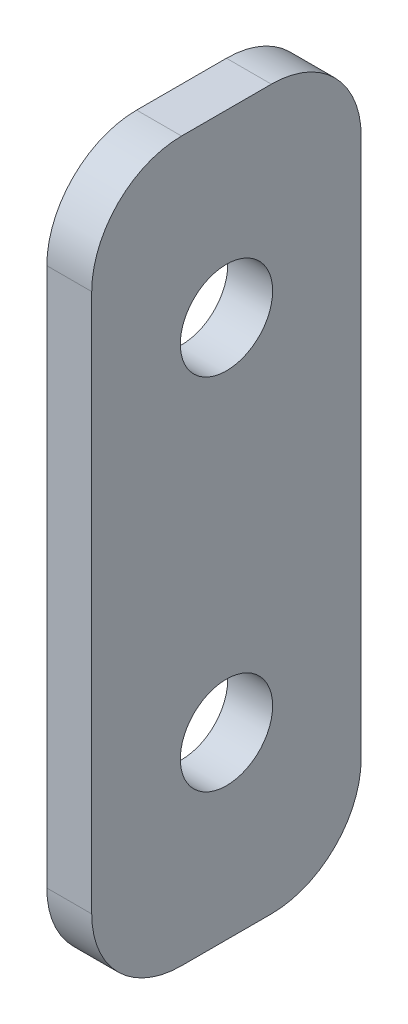
from build123d import *

# Parameters (mm, degrees)
SKETCH1_W               = 19.05
SKETCH1_H               = 50.8
BOSS_EXTRUDE1_DEPTH     = 1.5875
F_1_4_CLEARANCE_HOLE1_D = 6.5278
FILLET1_R               = 6.35


with BuildPart() as part:
    # Sketch1 → Boss-Extrude1 (new, symmetric)
    with BuildSketch(Plane(origin=(0, 0, 0), x_dir=(0, 0, -1), z_dir=(1, 0, 0))):
        Rectangle(SKETCH1_W, SKETCH1_H)
    extrude(amount=BOSS_EXTRUDE1_DEPTH, both=True)

    # 1/4 Clearance Hole1 (through all)
    with Locations(Plane(origin=(1.5875, 0, 0), x_dir=(0, 0, -1), z_dir=(1, 0, 0))):
        with Locations((0, 12.7), (0, -12.7)):
            Hole(F_1_4_CLEARANCE_HOLE1_D / 2)

    # Fillet1
    fillet1_edges = [part.edges().sort_by_distance(p)[0] for p in [
        (0, -25.4, -9.525),
        (0, -25.4, 9.525),
        (0, 25.4, 9.525),
        (0, 25.4, -9.525),
    ]]
    fillet(fillet1_edges, radius=FILLET1_R)


solid = part.part
